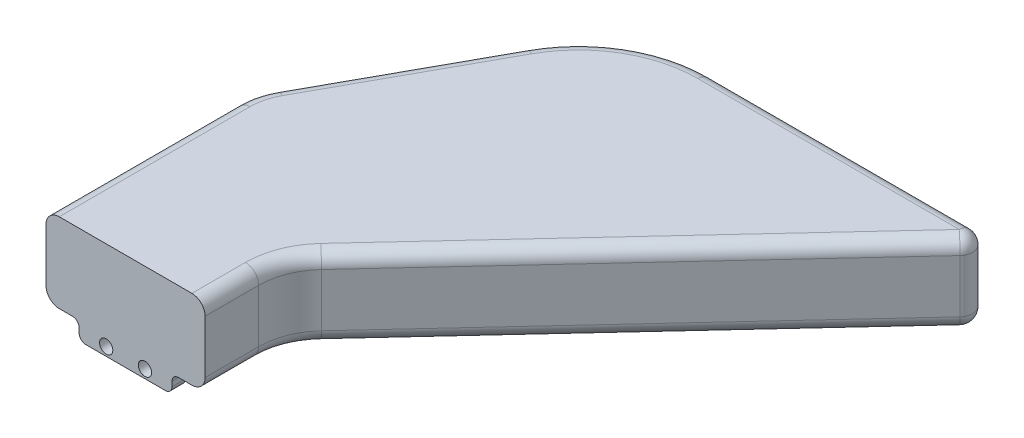
from build123d import *

# Parameters (mm, degrees)
BOSS_EXTRUDE1_DEPTH = 6
FILLET1_R           = 1
FILLET2_R           = 1
SKETCH3_W           = 7
SKETCH3_H           = 1.35
BOSS_EXTRUDE3_DEPTH = 1
FILLET5_R           = 0.5
SKETCH6_R           = 0.5
CUT_EXTRUDE2_DEPTH  = 1


with BuildPart() as part:
    # Sketch1 → Boss-Extrude1 (new body)
    with BuildSketch(Plane(origin=(0, 0, 0), x_dir=(1, 0, 0), z_dir=(0, 1, 0))):
        with BuildLine():
            Line((-11.381708203, 10.791631839), (-4.712422066, 22.925104071))
            ThreePointArc((-4.712422066, 22.925104071), (-1.039732152, 26.715438863), (4.050994341, 28.108203315))
            Line((4.050994341, 28.108203315), (23.765326904, 28.108203315))
            ThreePointArc((23.765326904, 28.108203315), (24.68179457, 27.508312073), (24.498700382, 26.428377351))
            Line((24.498700382, 26.428377351), (1.333132609, 1.438138803))
            ThreePointArc((1.333132609, 1.438138803), (0.345199416, -0.135386591), (0, -1.960991017))
            Line((0, -1.960991017), (0, -6))
            Line((0, -6), (-12, -6))
            Line((-12, -6), (-12, 8.383181461))
            ThreePointArc((-12, 8.383181461), (-11.842960924, 9.626455161), (-11.381708203, 10.791631839))
        make_face()
    extrude(amount=BOSS_EXTRUDE1_DEPTH)

    # Fillet1
    fillet1_edges = [part.edges().sort_by_distance(p)[0] for p in [
        (-11.842960924, 6, -9.626455161),
        (-12, 6, -1.191590731),
        (0, 6, 3.980495509),
        (0.345199416, 6, 0.135386591),
        (12.915916496, 6, -13.933258077),
        (24.68179457, 6, -27.508312073),
        (13.908160623, 6, -28.108203315),
        (-1.039732152, 6, -26.715438863),
        (-8.047065134, 6, -16.858367955),
    ]]
    fillet(fillet1_edges, radius=FILLET1_R)

    # Fillet2
    fillet2_edges = [part.edges().sort_by_distance(p)[0] for p in [
        (12.915916496, 0, -13.933258077),
        (0.345199416, 0, 0.135386591),
        (0, 0, 3.980495509),
        (-12, 0, -1.191590731),
        (-11.842960924, 0, -9.626455161),
        (-8.047065134, 0, -16.858367955),
        (-1.039732152, 0, -26.715438863),
        (13.908160623, 0, -28.108203315),
        (24.68179457, 0, -27.508312073),
    ]]
    fillet(fillet2_edges, radius=FILLET2_R)

    # Sketch3 → Boss-Extrude3 (add)
    with BuildSketch(Plane.XY.offset(6)):
        with Locations((-6, -0.675)):
            Rectangle(SKETCH3_W, SKETCH3_H)
    extrude(amount=-BOSS_EXTRUDE3_DEPTH)

    # Fillet5
    fillet5_edges = [part.edges().sort_by_distance(p)[0] for p in [
        (-9.5, 0, 5.5),
        (-2.5, 0, 5.5),
        (-2.5, -1.35, 5.5),
        (-9.5, -1.35, 5.5),
    ]]
    fillet(fillet5_edges, radius=FILLET5_R)

    # Sketch6 → Cut-Extrude2 (cut)
    with BuildSketch(Plane.XY.offset(6)):
        with Locations((-4.538139126, -0.7)):
            Circle(SKETCH6_R)
        with Locations(Location((-7.461860874, -0.7, 0), (0, 0, 180))):
            Circle(SKETCH6_R)
    extrude(amount=-CUT_EXTRUDE2_DEPTH, mode=Mode.SUBTRACT)


solid = part.part
